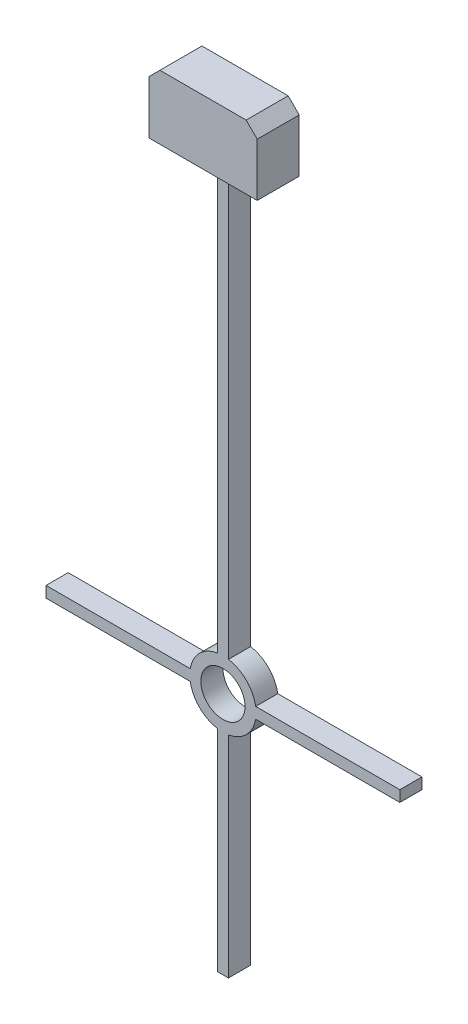
from build123d import *

# Parameters (mm, degrees)
SKETCH_1_R          = 1
EXTRUDE_1_DEPTH     = 0.5
SKETCH_2_W          = 4.9
SKETCH_2_H          = 2.9
EXTRUDE_2_DEPTH     = 1.4
SKETCH_2_2_W        = 4.9
SKETCH_2_2_H        = 2.9
EXTRUDE_3_DEPTH     = 0.5
CHAMFER_1_SIZE      = 0.5
CHAMFER_2_SIZE      = 0.5
SKETCH_3_W          = 11.619186974
SKETCH_3_H          = 20
CUT_EXTRUDE_1_DEPTH = 5


with BuildPart() as part:
    # 스케치1 → 보스-돌출1 (new, symmetric)
    with BuildSketch(Plane.XY):
        with BuildLine():
            ThreePointArc((-0.25, -1.479019946), (-1.060660172, -1.060660172), (-1.479019946, -0.25))
            Line((-1.479019946, -0.25), (-8, -0.25))
            Line((-8, -0.25), (-8, 0.25))
            Line((-8, 0.25), (-1.479019946, 0.25))
            ThreePointArc((-1.479019946, 0.25), (-1.060660172, 1.060660172), (-0.25, 1.479019946))
            Line((-0.25, 1.479019946), (-0.25, 21))
            Line((-0.25, 21), (0.25, 21))
            Line((0.25, 21), (0.25, 1.479019946))
            ThreePointArc((0.25, 1.479019946), (1.060660172, 1.060660172), (1.479019946, 0.25))
            Line((1.479019946, 0.25), (8, 0.25))
            Line((8, 0.25), (8, -0.25))
            Line((8, -0.25), (1.479019946, -0.25))
            ThreePointArc((1.479019946, -0.25), (1.060660172, -1.060660172), (0.25, -1.479019946))
            Line((0.25, -1.479019946), (0.25, -21))
            Line((0.25, -21), (-0.25, -21))
            Line((-0.25, -21), (-0.25, -1.479019946))
        make_face()
        Circle(SKETCH_1_R, mode=Mode.SUBTRACT)
    extrude(amount=EXTRUDE_1_DEPTH, both=True)

    # 스케치2 → 보스-돌출2 (add)
    with BuildSketch(Plane.XY):
        with Locations((0, 22.45)):
            Rectangle(SKETCH_2_W, SKETCH_2_H)
    extrude(amount=EXTRUDE_2_DEPTH)

    # 스케치2<2> → 보스-돌출3 (add)
    with BuildSketch(Plane.XY):
        with Locations((0, 22.45)):
            Rectangle(SKETCH_2_2_W, SKETCH_2_2_H)
    extrude(amount=-EXTRUDE_3_DEPTH)

    # 모따기1
    chamfer_1_edges = [part.edges().sort_by_distance(p)[0] for p in [
        (2.45, 23.9, 0.45),
        (-2.45, 23.9, 0.45),
    ]]
    chamfer(chamfer_1_edges, length=CHAMFER_1_SIZE)

    # 모따기2
    chamfer_2_edges = [part.edges().sort_by_distance(p)[0] for p in [
        (-0.25, 21, 0),
        (0.25, 21, 0),
    ]]
    chamfer(chamfer_2_edges, length=CHAMFER_2_SIZE)

    # 스케치3 → 컷-돌출1 (cut, symmetric)
    with BuildSketch(Plane.XY):
        with Locations((0, -21)):
            Rectangle(SKETCH_3_W, SKETCH_3_H)
    extrude(amount=CUT_EXTRUDE_1_DEPTH, both=True, mode=Mode.SUBTRACT)


solid = part.part
